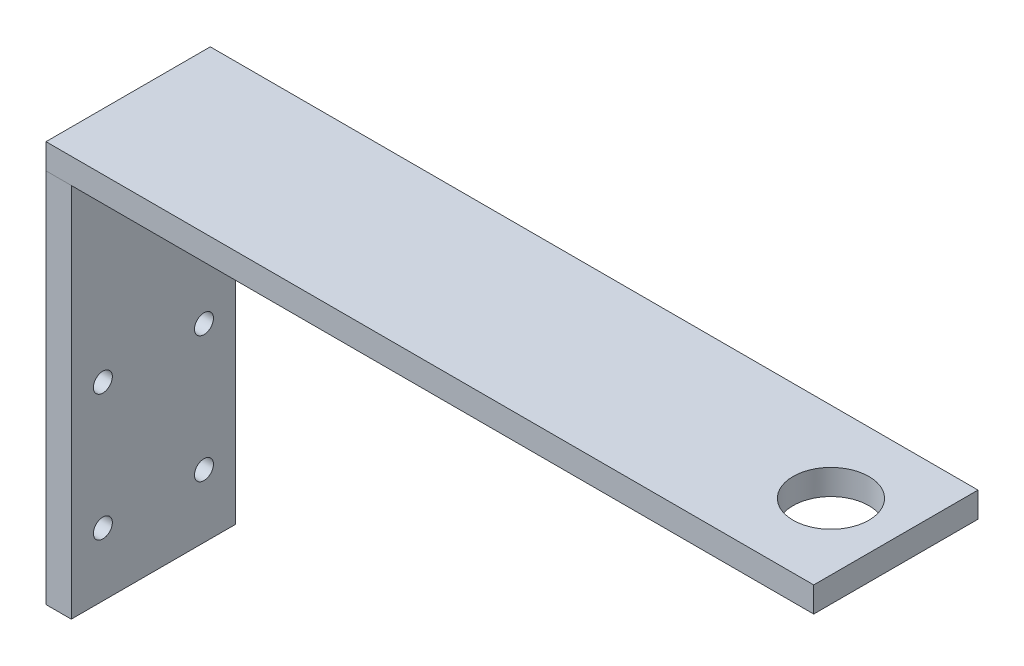
from build123d import *

# Parameters (mm, degrees)
SKETCH2_W           = 26
SKETCH2_H           = 4
BOSS_EXTRUDE1_DEPTH = 117.5
CUT_EXTRUDE2_REACH  = 194.98
SKETCH4_R           = 6
SKETCH5_W           = 4
SKETCH5_H           = 26
BOSS_EXTRUDE2_DEPTH = 63.45
CUT_EXTRUDE3_REACH  = 162.104
SKETCH6_R           = 1.5


with BuildPart() as part:
    # Sketch2 → Boss-Extrude1 (new body)
    with BuildSketch(Plane.ZY.offset(-75)):
        with Locations((0, 101.45)):
            Rectangle(SKETCH2_W, SKETCH2_H)
    extrude(amount=-BOSS_EXTRUDE1_DEPTH)

    # Sketch4 → Cut-Extrude2 (cut, up to next)
    with BuildSketch(Plane.XZ.offset(-99.45), mode=Mode.PRIVATE) as cut_extrude2_sk1:
        with Locations(Location((182, -0.23, 0), (0, 0, 270))):
            Circle(SKETCH4_R)
    cut_extrude2_tool1 = extrude(cut_extrude2_sk1.sketch, amount=-CUT_EXTRUDE2_REACH, mode=Mode.PRIVATE) & part.part
    add(cut_extrude2_tool1.solids().sort_by_distance((182, 99.45, -0.23))[0], mode=Mode.SUBTRACT)

    # Sketch5 → Boss-Extrude2 (add)
    with BuildSketch(Plane(origin=(0, 103.45, 0), x_dir=(1, 0, 0), z_dir=(0, 1, 0))):
        with Locations((73, 0)):
            Rectangle(SKETCH5_W, SKETCH5_H)
    extrude(amount=-BOSS_EXTRUDE2_DEPTH)

    # Sketch6 → Cut-Extrude3 (cut, up to next)
    with BuildSketch(Plane.ZY.offset(-71), mode=Mode.PRIVATE) as cut_extrude3_sk1:
        with Locations((-8, 70)):
            Circle(SKETCH6_R)
    cut_extrude3_tool1 = extrude(cut_extrude3_sk1.sketch, amount=-CUT_EXTRUDE3_REACH, mode=Mode.PRIVATE) & part.part
    # Sketch6 → Cut-Extrude3 (cut, up to next)
    with BuildSketch(Plane.ZY.offset(-71), mode=Mode.PRIVATE) as cut_extrude3_sk2:
        with Locations((8, 70)):
            Circle(SKETCH6_R)
    cut_extrude3_tool2 = extrude(cut_extrude3_sk2.sketch, amount=-CUT_EXTRUDE3_REACH, mode=Mode.PRIVATE) & part.part
    # Sketch6 → Cut-Extrude3 (cut, up to next)
    with BuildSketch(Plane.ZY.offset(-71), mode=Mode.PRIVATE) as cut_extrude3_sk3:
        with Locations((-8, 50)):
            Circle(SKETCH6_R)
    cut_extrude3_tool3 = extrude(cut_extrude3_sk3.sketch, amount=-CUT_EXTRUDE3_REACH, mode=Mode.PRIVATE) & part.part
    # Sketch6 → Cut-Extrude3 (cut, up to next)
    with BuildSketch(Plane.ZY.offset(-71), mode=Mode.PRIVATE) as cut_extrude3_sk4:
        with Locations((8, 50)):
            Circle(SKETCH6_R)
    cut_extrude3_tool4 = extrude(cut_extrude3_sk4.sketch, amount=-CUT_EXTRUDE3_REACH, mode=Mode.PRIVATE) & part.part
    add(cut_extrude3_tool1.solids().sort_by_distance((71, 70, -8))[0], mode=Mode.SUBTRACT)
    add(cut_extrude3_tool2.solids().sort_by_distance((71, 70, 8))[0], mode=Mode.SUBTRACT)
    add(cut_extrude3_tool3.solids().sort_by_distance((71, 50, -8))[0], mode=Mode.SUBTRACT)
    add(cut_extrude3_tool4.solids().sort_by_distance((71, 50, 8))[0], mode=Mode.SUBTRACT)


with BuildPart() as body_2:
    # Split1: the piece on the far side of the plane
    add(part.part)
    split(bisect_by=Plane(origin=(0, 99.45, 0), x_dir=(0, 0, -1), z_dir=(0, -1, 0)), keep=Keep.BOTTOM)


with BuildPart() as part_1:
    add(part.part)

    # Split1
    split(bisect_by=Plane(origin=(0, 99.45, 0), x_dir=(0, 0, -1), z_dir=(0, -1, 0)), keep=Keep.TOP)


solid = Compound([body_2.part, part_1.part])
